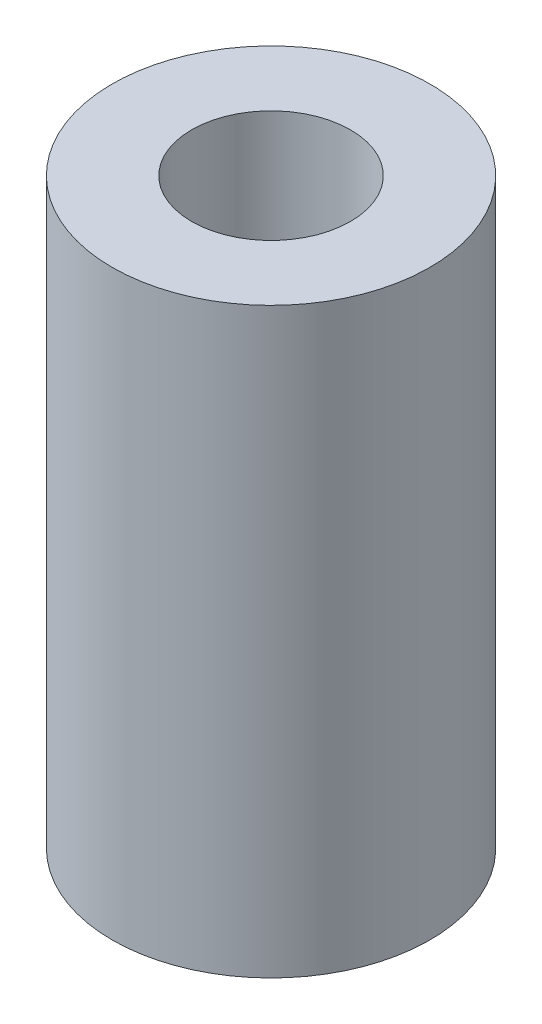
from build123d import *

# Parameters (mm, degrees)
SKETCH1_R           = 3
SKETCH1_R_2         = 1.5
BOSS_EXTRUDE1_DEPTH = 11


with BuildPart() as part:
    # Sketch1 → Boss-Extrude1 (new body)
    with BuildSketch(Plane(origin=(0, 0, 0), x_dir=(1, 0, 0), z_dir=(0, 1, 0))):
        with Locations(Location((0, 0, 0), (0, 0, 270))):
            Circle(SKETCH1_R)
        with Locations(Location((0, 0, 0), (0, 0, 270))):
            Circle(SKETCH1_R_2, mode=Mode.SUBTRACT)
    extrude(amount=BOSS_EXTRUDE1_DEPTH)


solid = part.part
